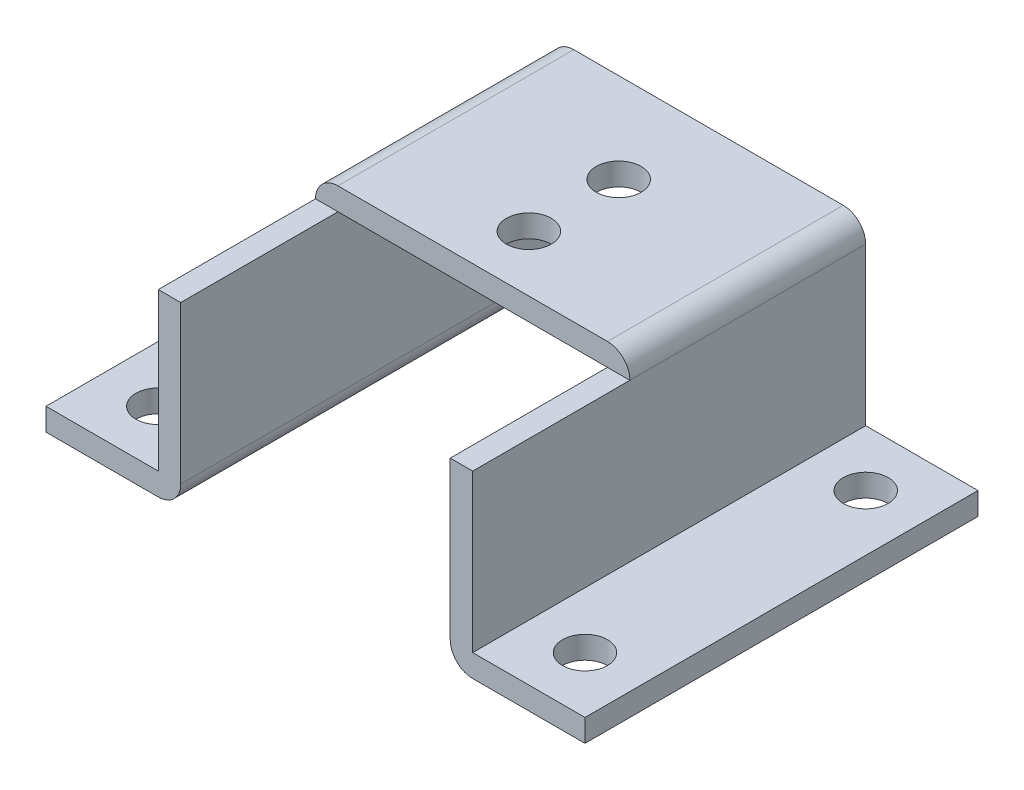
from build123d import *

# Parameters (mm, degrees)
BOSS_EXTRUDE1_DEPTH      = 35
FILLET1_R                = 2
FILLET2_R                = 2
SKETCH4_W                = 28
SKETCH4_H                = 14
CUT_EXTRUDE2_DEPTH       = 2
FILLET3_R                = 2
FILLET4_R                = 2
F_4_0_4_DIAMETER_HOLE1_D = 4


with BuildPart() as part:
    # Sketch1 → Boss-Extrude1 (new body)
    with BuildSketch(Plane.XY):
        Polygon((-12, 3.174979041), (-12, -12.825020959), (-24, -12.825020959), (-24, -10.825020959), (-14, -10.825020959), (-14, 5.174979041), (14, 5.174979041), (14, -10.825020959), (24, -10.825020959), (24, -12.825020959), (12, -12.825020959), (12, 3.174979041), align=None)
    extrude(amount=-BOSS_EXTRUDE1_DEPTH)

    # Fillet1
    fillet1_edges = [part.edges().sort_by_distance(p)[0] for p in [
        (-14, 5.174979041, -17.5),
    ]]
    fillet(fillet1_edges, radius=FILLET1_R)

    # Fillet2
    fillet2_edges = [part.edges().sort_by_distance(p)[0] for p in [
        (14, 5.174979041, -17.5),
    ]]
    fillet(fillet2_edges, radius=FILLET2_R)

    # Sketch4 → Cut-Extrude2 (cut)
    with BuildSketch(Plane(origin=(0, 5.174979041, 0), x_dir=(1, 0, 0), z_dir=(0, 1, 0))):
        with Locations((0, 7)):
            Rectangle(SKETCH4_W, SKETCH4_H)
    extrude(amount=-CUT_EXTRUDE2_DEPTH, mode=Mode.SUBTRACT)

    # Fillet3
    fillet3_edges = [part.edges().sort_by_distance(p)[0] for p in [
        (12, -12.825020959, -17.5),
    ]]
    fillet(fillet3_edges, radius=FILLET3_R)

    # Fillet4
    fillet4_edges = [part.edges().sort_by_distance(p)[0] for p in [
        (-12, -12.825020959, -17.5),
    ]]
    fillet(fillet4_edges, radius=FILLET4_R)

    # Ø4.0 (4) Diameter Hole1 (through all)
    with Locations(Plane(origin=(0, 5.174979041, 0), x_dir=(1, 0, 0), z_dir=(0, 1, 0))):
        with Locations((-19, 30), (-19, 5), (0, 27), (0, 19), (19, 30), (19, 5)):
            Hole(F_4_0_4_DIAMETER_HOLE1_D / 2)


solid = part.part
